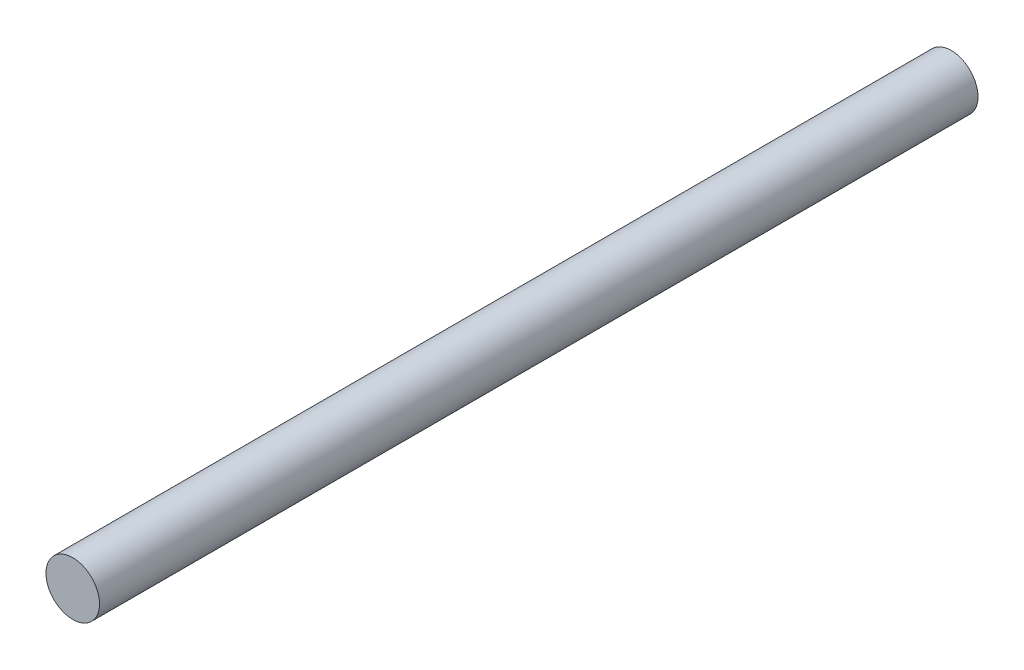
from build123d import *

# Parameters (mm, degrees)
SKETCH1_R           = 2.5
BOSS_EXTRUDE1_DEPTH = 41


with BuildPart() as part:
    # Sketch1 → Boss-Extrude1 (new, symmetric)
    with BuildSketch(Plane.XY):
        Circle(SKETCH1_R)
    extrude(amount=BOSS_EXTRUDE1_DEPTH, both=True)


solid = part.part
